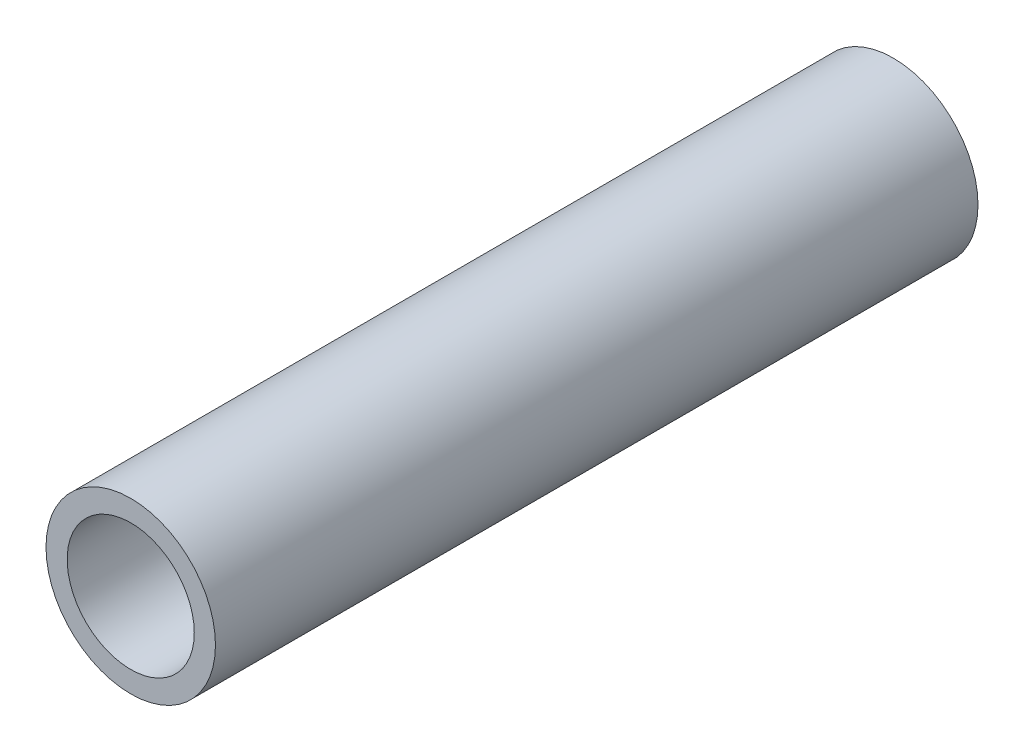
from build123d import *

# Parameters (mm, degrees)
SKETCH1_R           = 20
BOSS_EXTRUDE1_DEPTH = 180
SKETCH2_R           = 15
CUT_EXTRUDE1_DEPTH  = 180


with BuildPart() as part:
    # Sketch1 → Boss-Extrude1 (new body)
    with BuildSketch(Plane.XY):
        with Locations(Location((0, 0, 0), (0, 0, 180))):
            Circle(SKETCH1_R)
    extrude(amount=BOSS_EXTRUDE1_DEPTH)

    # Sketch2 → Cut-Extrude1 (cut)
    with BuildSketch(Plane.XY.offset(180)):
        Circle(SKETCH2_R)
    extrude(amount=-CUT_EXTRUDE1_DEPTH, mode=Mode.SUBTRACT)


solid = part.part
